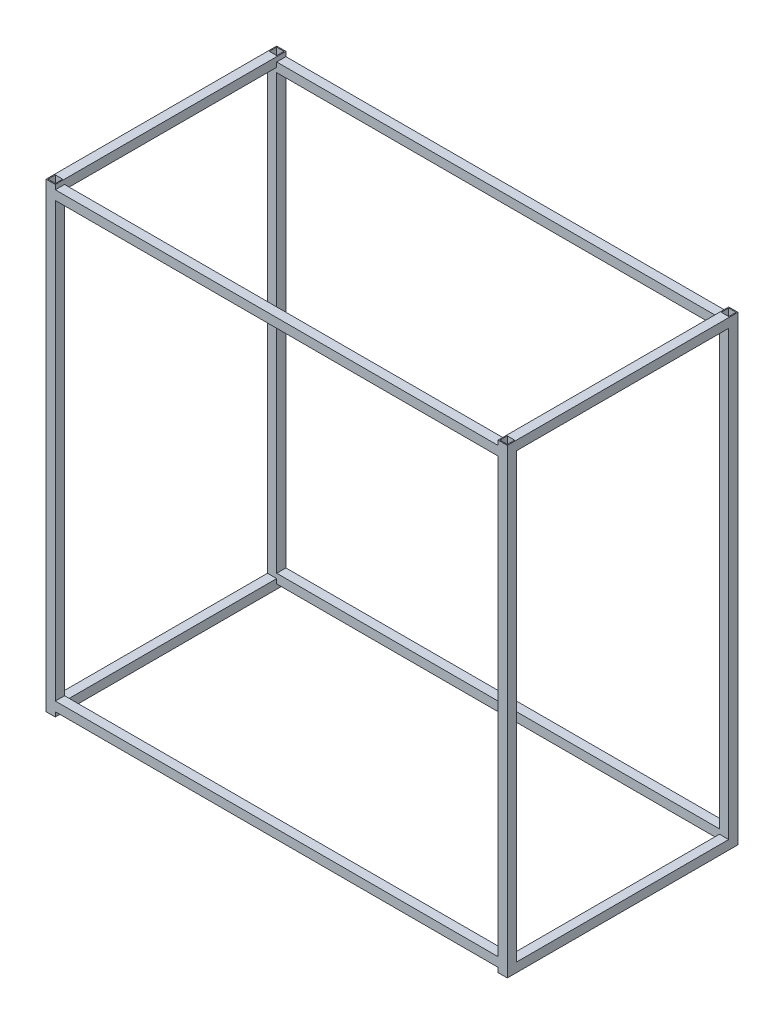
from build123d import *

# Parameters (mm, degrees)
SKETCH_1_W          = 1440
SKETCH_1_H          = 1410
EXTRUDE_1_DEPTH     = 750
SKETCH_2_W          = 690
SKETCH_2_H          = 1440
CUT_EXTRUDE_1_DEPTH = 2251
SKETCH_3_W          = 1440
SKETCH_3_H          = 690
CUT_EXTRUDE_2_DEPTH = 2241.027901612
SKETCH_4_W          = 24
SKETCH_4_H          = 24
CUT_EXTRUDE_3_DEPTH = 2251


with BuildPart() as part:
    # Эскиз1 → Бобышка-Вытянуть1 (new body)
    with BuildSketch(Plane.XY):
        Polygon((30, 1500), (30, 1485), (1470, 1485), (1470, 1500), (1500, 1500), (1500, 0), (1470, 0), (1470, 15), (30, 15), (30, 0), (0, 0), (0, 1500), align=None)
        with Locations((750, 750)):
            Rectangle(SKETCH_1_W, SKETCH_1_H, mode=Mode.SUBTRACT)
    extrude(amount=EXTRUDE_1_DEPTH)

    # Эскиз2 → Вырез-Вытянуть1 (cut, through all)
    with BuildSketch(Plane(origin=(1500, 0, 0), x_dir=(0, 0, -1), z_dir=(1, 0, 0))):
        with Locations((-375, 750)):
            Rectangle(SKETCH_2_W, SKETCH_2_H)
    extrude(amount=-CUT_EXTRUDE_1_DEPTH, mode=Mode.SUBTRACT)

    # Эскиз3 → Вырез-Вытянуть2 (cut, through all)
    with BuildSketch(Plane(origin=(0, 1485, 0), x_dir=(1, 0, 0), z_dir=(0, 1, 0))):
        with Locations((750, -375)):
            Rectangle(SKETCH_3_W, SKETCH_3_H)
    extrude(amount=-CUT_EXTRUDE_2_DEPTH, mode=Mode.SUBTRACT)

    # Эскиз4 → Вырез-Вытянуть3 (cut, through all)
    with BuildSketch(Plane(origin=(0, 1500, 0), x_dir=(1, 0, 0), z_dir=(0, 1, 0))):
        with Locations((15, -15)):
            Rectangle(SKETCH_4_W, SKETCH_4_H)
        with Locations((1485, -735)):
            Rectangle(SKETCH_4_W, SKETCH_4_H)
        with Locations((1485, -15)):
            Rectangle(SKETCH_4_W, SKETCH_4_H)
        with Locations((15, -735)):
            Rectangle(SKETCH_4_W, SKETCH_4_H)
    extrude(amount=-CUT_EXTRUDE_3_DEPTH, mode=Mode.SUBTRACT)


solid = part.part
